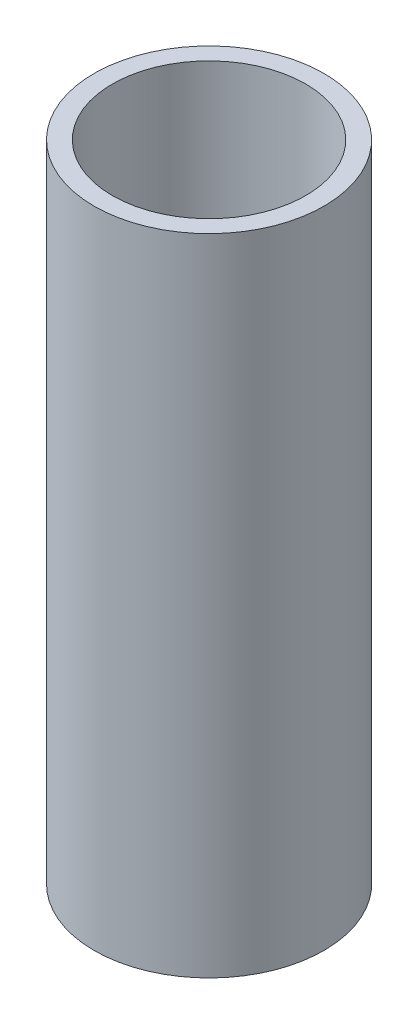
from build123d import *

# Parameters (mm, degrees)
SKETCH1_R           = 0.535
SKETCH1_R_2         = 0.45
BOSS_EXTRUDE1_DEPTH = 3


with BuildPart() as part:
    # Sketch1 → Boss-Extrude1 (new body)
    with BuildSketch(Plane(origin=(0, 0, 0), x_dir=(1, 0, 0), z_dir=(0, 1, 0))):
        with Locations(Location((0, 0, 0), (0, 0, 270))):
            Circle(SKETCH1_R)
        with Locations(Location((0, 0, 0), (0, 0, 270))):
            Circle(SKETCH1_R_2, mode=Mode.SUBTRACT)
    extrude(amount=BOSS_EXTRUDE1_DEPTH)


solid = part.part
